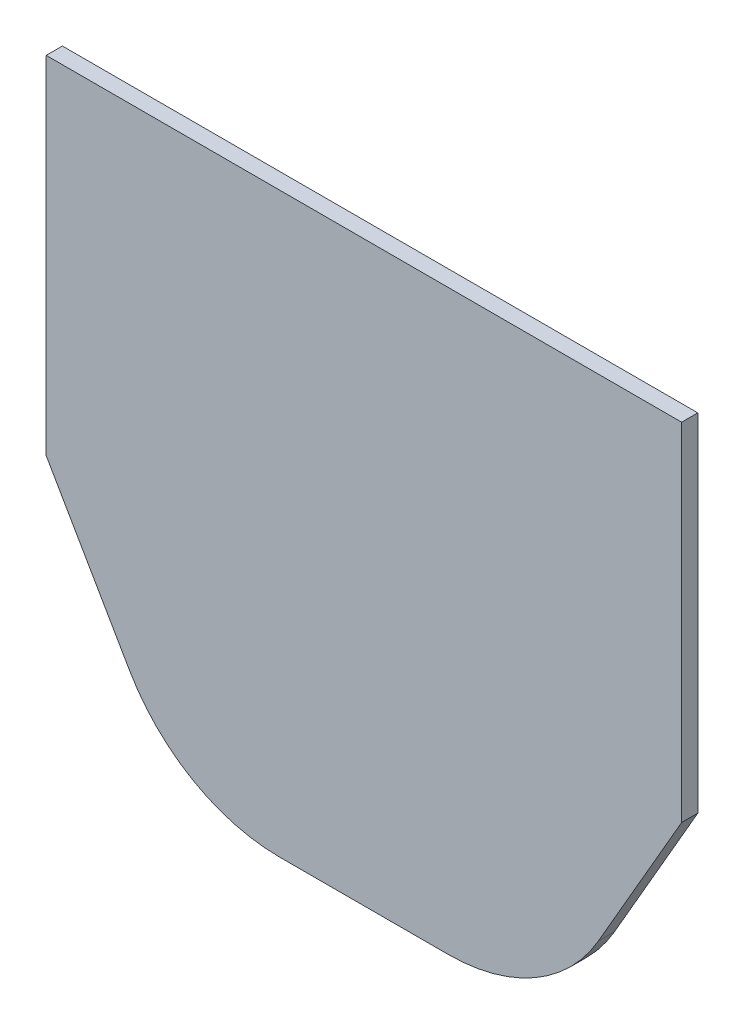
from build123d import *

# Parameters (mm, degrees)
BOSS_EXTRUDE1_DEPTH = 3.556


with BuildPart() as part:
    # Sketch1 → Boss-Extrude1 (new body)
    with BuildSketch(Plane.XY):
        with BuildLine():
            Line((-161.499532604, 280.561645896), (-161.499532604, 356.788581407))
            Line((-161.499532604, 356.788581407), (-301.19953221, 356.788581407))
            Line((-301.19953221, 356.788581407), (-301.19953221, 280.561645896))
            Line((-301.19953221, 280.561645896), (-282.884212388, 248.838581407))
            ThreePointArc((-282.884212388, 248.838581407), (-268.938644504, 234.893013523), (-249.888644504, 229.788581407))
            Line((-249.888644504, 229.788581407), (-212.81042031, 229.788581407))
            ThreePointArc((-212.81042031, 229.788581407), (-193.76042031, 234.893013523), (-179.814852426, 248.838581407))
            Line((-179.814852426, 248.838581407), (-161.499532604, 280.561645896))
        make_face()
    extrude(amount=-BOSS_EXTRUDE1_DEPTH)


solid = part.part
